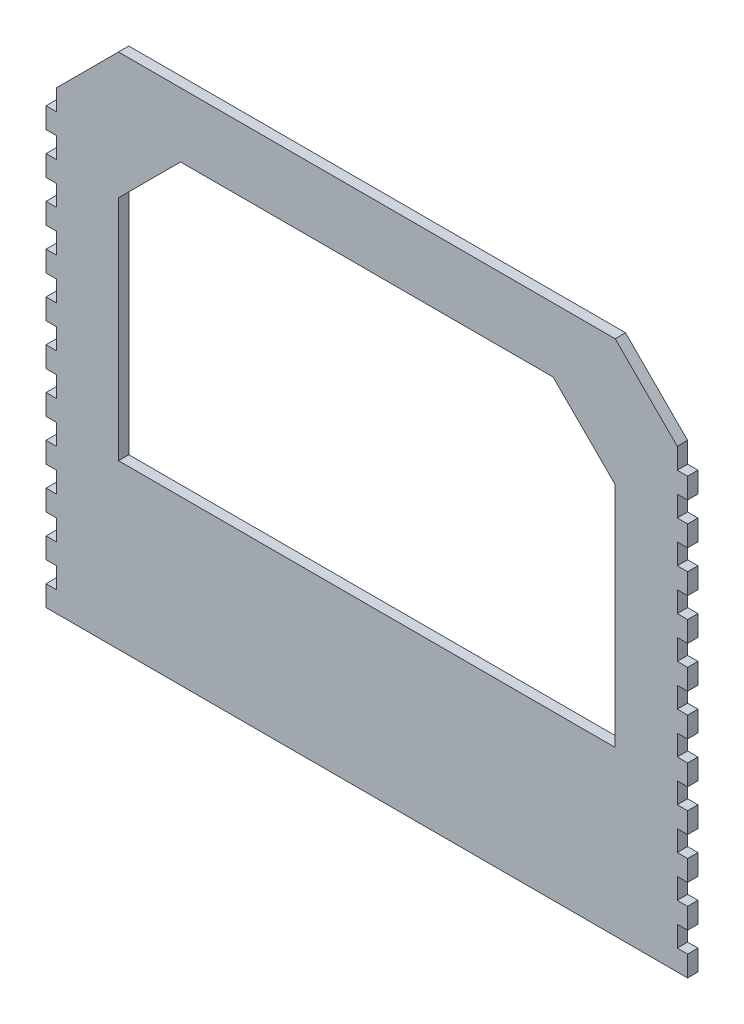
from build123d import *

# Parameters (mm, degrees)
AUFSATZ_LINEAR_AUSTRAGEN1_DEPTH = 5


with BuildPart() as part:
    # Skizze1 → Aufsatz-Linear austragen1 (new body)
    with BuildSketch(Plane.XY):
        Polygon((430.89618142, 326.340211581), (430.89618142, 336.340211581), (425.89618142, 336.340211581), (425.89618142, 346.340211581), (430.89618142, 346.340211581), (430.89618142, 356.340211581), (425.89618142, 356.340211581), (425.89618142, 366.340211581), (430.89618142, 366.340211581), (430.89618142, 376.340211581), (425.89618142, 376.340211581), (425.89618142, 386.340211581), (430.89618142, 386.340211581), (430.89618142, 396.340211581), (425.89618142, 396.340211581), (425.89618142, 406.340211581), (430.89618142, 406.340211581), (430.89618142, 416.340211581), (425.89618142, 416.340211581), (425.89618142, 426.340211581), (430.89618142, 426.340211581), (430.89618142, 436.340211581), (425.89618142, 436.340211581), (425.89618142, 446.340211581), (430.89618142, 446.340211581), (430.89618142, 456.340211581), (425.89618142, 456.340211581), (425.89618142, 466.340211581), (430.89618142, 466.340211581), (430.89618142, 476.340211581), (425.89618142, 476.340211581), (425.89618142, 486.340211581), (430.89618142, 486.340211581), (430.89618142, 496.340211581), (425.89618142, 496.340211581), (425.89618142, 506.340211581), (430.89618142, 506.340211581), (430.89618142, 516.340211581), (425.89618142, 516.340211581), (425.89618142, 526.340211581), (430.89618142, 526.340211581), (430.89618142, 536.340211581), (460.89618142, 566.340211581), (700.89618142, 566.340211581), (730.89618142, 536.340211581), (730.89618142, 526.340211581), (735.89618142, 526.340211581), (735.89618142, 516.340211581), (730.89618142, 516.340211581), (730.89618142, 506.340211581), (735.89618142, 506.340211581), (735.89618142, 496.340211581), (730.89618142, 496.340211581), (730.89618142, 486.340211581), (735.89618142, 486.340211581), (735.89618142, 476.340211581), (730.89618142, 476.340211581), (730.89618142, 466.340211581), (735.89618142, 466.340211581), (735.89618142, 456.340211581), (730.89618142, 456.340211581), (730.89618142, 446.340211581), (735.89618142, 446.340211581), (735.89618142, 436.340211581), (730.89618142, 436.340211581), (730.89618142, 426.340211581), (735.89618142, 426.340211581), (735.89618142, 416.340211581), (730.89618142, 416.340211581), (730.89618142, 406.340211581), (735.89618142, 406.340211581), (735.89618142, 396.340211581), (730.89618142, 396.340211581), (730.89618142, 386.340211581), (735.89618142, 386.340211581), (735.89618142, 376.340211581), (730.89618142, 376.340211581), (730.89618142, 366.340211581), (735.89618142, 366.340211581), (735.89618142, 356.340211581), (730.89618142, 356.340211581), (730.89618142, 346.340211581), (735.89618142, 346.340211581), (735.89618142, 336.340211581), (730.89618142, 336.340211581), (730.89618142, 326.340211581), (735.89618142, 326.340211581), (735.89618142, 316.340211581), (730.89618142, 316.340211581), (430.89618142, 316.340211581), (425.89618142, 316.340211581), (425.89618142, 326.340211581), align=None)
        Polygon((700.89618142, 505.311376979), (670.89618142, 535.311376979), (490.89618142, 535.311376979), (460.89618142, 505.311376979), (460.89618142, 395.311376979), (700.89618142, 395.311376979), align=None, mode=Mode.SUBTRACT)
    extrude(amount=AUFSATZ_LINEAR_AUSTRAGEN1_DEPTH)


solid = part.part
